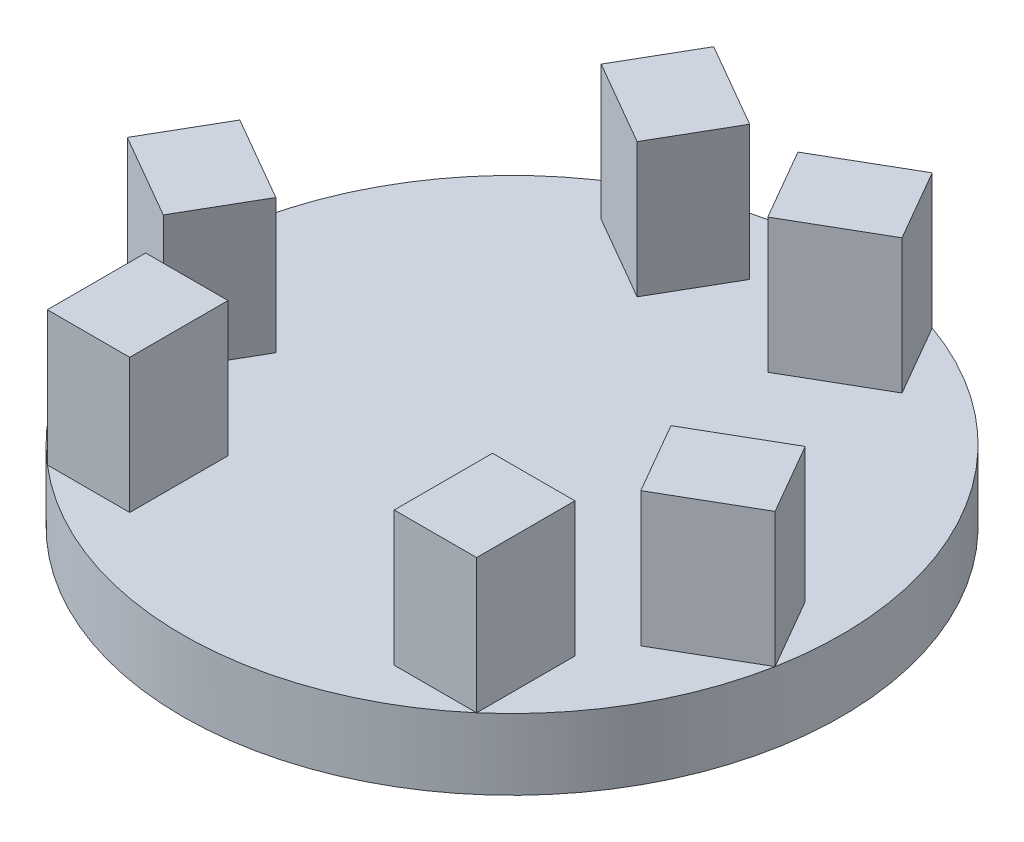
from build123d import *

# Parameters (mm, degrees)
ESQUISSE1_R        = 114
BOSS_EXTRU_1_DEPTH = 24.5
ESQUISSE2_W        = 28.5
ESQUISSE2_H        = 34
BOSS_EXTRU_2_DEPTH = 46.5


with BuildPart() as part:
    # Esquisse1 → Boss.-Extru.1 (new body)
    with BuildSketch(Plane(origin=(0, 0, 0), x_dir=(1, 0, 0), z_dir=(0, 1, 0))):
        with Locations(Location((0, 0, 0), (0, 0, 270))):
            Circle(ESQUISSE1_R)
    extrude(amount=BOSS_EXTRU_1_DEPTH)

    # Esquisse2 → Boss.-Extru.2 (add)
    with BuildSketch(Plane(origin=(0, 24.5, 0), x_dir=(1, 0, 0), z_dir=(0, 1, 0))):
        Polygon((-8.344775195, 90.55437318), (-37.789638923, 107.55437318), (-52.039638923, 82.872649172), (-22.594775195, 65.872649172), align=None)
        with Locations((-60, -69.503973897)):
            Rectangle(ESQUISSE2_W, ESQUISSE2_H)
        with Locations((60, -69.503973897)):
            Rectangle(ESQUISSE2_W, ESQUISSE2_H)
        Polygon((-68.344775195, -13.368675275), (-97.789638923, 3.631324725), (-112.039638923, -21.050399282), (-82.594775195, -38.050399282), align=None)
        Polygon((82.594775195, -38.050399282), (112.039638923, -21.050399282), (97.789638923, 3.631324725), (68.344775195, -13.368675275), align=None)
        Polygon((22.594775195, 65.872649172), (52.039638923, 82.872649172), (37.789638923, 107.55437318), (8.344775195, 90.55437318), align=None)
    extrude(amount=BOSS_EXTRU_2_DEPTH)


solid = part.part
